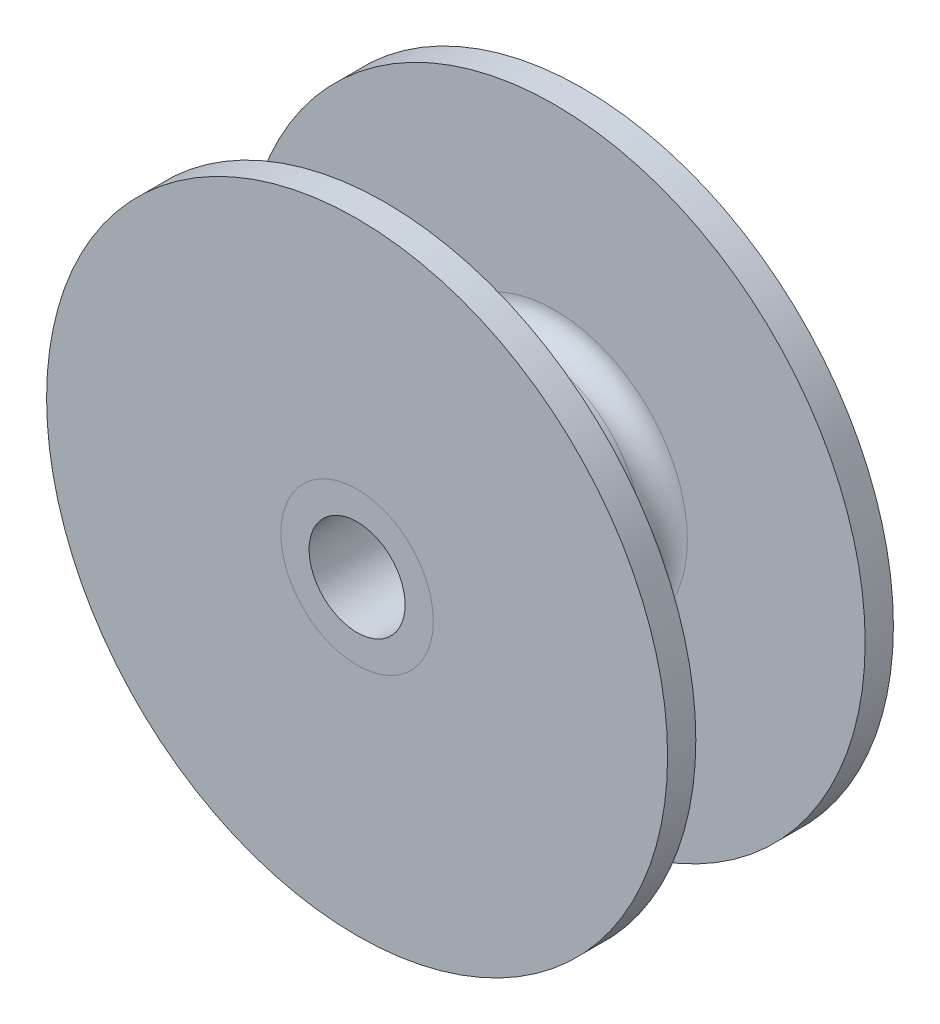
from build123d import *

# Parameters (mm, degrees)
SKETCH2_W               = 80
SKETCH2_H               = 110
SKETCH6_R               = 27
CUT_EXTRUDE2_DEPTH      = 175.928556845
CUT_EXTRUDE3_DEPTH      = 175.928556845
CUT_EXTRUDE3_DEPTH_BACK = 175.928556845
SKETCH7_R               = 2
SKETCH8_R               = 27
SKETCH8_R_2             = 17
BOSS_EXTRUDE1_DEPTH     = 25


with BuildPart() as part:
    # Sketch2 → Revolve1 (revolve)
    with BuildSketch(Plane(origin=(0, 0, 0), x_dir=(0, 0, -1), z_dir=(1, 0, 0)), mode=Mode.PRIVATE) as revolve1_sk:
        with Locations((40, 55)):
            Rectangle(SKETCH2_W, SKETCH2_H)
    revolve(revolve1_sk.sketch.rotate(Axis((0, 0, 0), (0, 0, -1)), 90), axis=Axis((0, 0, 0), (0, 0, -1)))

    # Sketch6 → Cut-Extrude2 (cut, through all)
    with BuildSketch(Plane.XY):
        Circle(SKETCH6_R)
    extrude(amount=-CUT_EXTRUDE2_DEPTH, mode=Mode.SUBTRACT)

    # Sketch7 → Cut-Extrude3 (cut, two sides: drawn at the far end of the back side and taken through both)
    with BuildSketch(Plane(origin=(0, 0, 0), x_dir=(1, 0, 0), z_dir=(0, 1, 0)).offset(-CUT_EXTRUDE3_DEPTH_BACK)):
        with Locations(Location((0, 40, 0), (0, 0, 270))):
            Circle(SKETCH7_R)
    extrude(amount=CUT_EXTRUDE3_DEPTH + CUT_EXTRUDE3_DEPTH_BACK, mode=Mode.SUBTRACT)

    # Sketch3 → Cut-Revolve1 (revolve, cut)
    with BuildSketch(Plane(origin=(0, 0, 0), x_dir=(0, 0, -1), z_dir=(1, 0, 0)), mode=Mode.PRIVATE) as cut_revolve1_sk:
        with BuildLine():
            Line((10, 110), (10, 47))
            ThreePointArc((10, 47), (12.343145751, 41.343145751), (18, 39))
            Line((18, 39), (62, 39))
            ThreePointArc((62, 39), (67.656854249, 41.343145751), (70, 47))
            Line((70, 47), (70, 110))
            Line((70, 110), (10, 110))
        make_face()
    revolve(cut_revolve1_sk.sketch.rotate(Axis((0, 0, 1000), (0, 0, -1)), 90), axis=Axis((0, 0, 1000), (0, 0, -1)), mode=Mode.SUBTRACT)


with BuildPart() as body_2:
    # Sketch8 → Boss-Extrude1 (new body)
    with BuildSketch(Plane.XY):
        Circle(SKETCH8_R)
        Circle(SKETCH8_R_2, mode=Mode.SUBTRACT)
    extrude(amount=-BOSS_EXTRUDE1_DEPTH)


with BuildPart() as body_3:
    # Mirror2: mirrored copy
    add(body_2.part.mirror(Plane.XY.offset(-40)))


solid = Compound([part.part, body_2.part, body_3.part])
